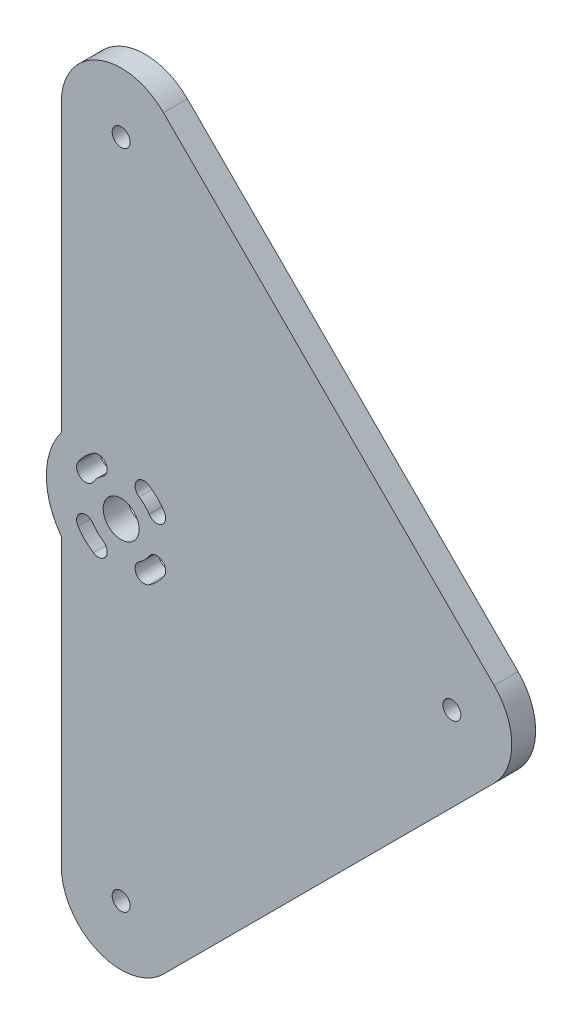
from build123d import *

# Parameters (mm, degrees)
SKETCH_1_R      = 3
SKETCH_1_R_2    = 1.5
EXTRUDE_1_DEPTH = 4


with BuildPart() as part:
    # 草图1 → 凸台-拉伸1 (new body)
    with BuildSketch(Plane.XY):
        with BuildLine():
            Line((1790.797367784, 1613.266845989), (1790.797367784, 1565.512011993))
            ThreePointArc((1790.797367784, 1565.512011993), (1788.297367784, 1558.012011993), (1790.797367784, 1550.512011993))
            Line((1790.797367784, 1550.512011993), (1790.797367784, 1502.757177997))
            ThreePointArc((1790.797367784, 1502.757177997), (1796.970533461, 1493.518382672), (1807.868435596, 1495.686110185))
            Line((1807.868435596, 1495.686110185), (1863.123269592, 1550.940944181))
            ThreePointArc((1863.123269592, 1550.940944181), (1866.05220178, 1558.012011993), (1863.123269592, 1565.083079805))
            Line((1863.123269592, 1565.083079805), (1807.868435596, 1620.337913801))
            ThreePointArc((1807.868435596, 1620.337913801), (1796.970533461, 1622.505641314), (1790.797367784, 1613.266845989))
        make_face()
        with Locations((1800.797367784, 1558.012011993)):
            Circle(SKETCH_1_R, mode=Mode.SUBTRACT)
        with Locations((1800.797367784, 1613.266845989)):
            Circle(SKETCH_1_R_2, mode=Mode.SUBTRACT)
        with Locations((1856.05220178, 1558.012011993)):
            Circle(SKETCH_1_R_2, mode=Mode.SUBTRACT)
        with Locations((1800.797367784, 1502.757177997)):
            Circle(SKETCH_1_R_2, mode=Mode.SUBTRACT)
        with BuildLine():
            ThreePointArc((1805.443255224, 1550.809308797), (1806.858027956, 1551.951351821), (1808.000070981, 1553.366124554))
            ThreePointArc((1808.000070981, 1553.366124554), (1807.55260939, 1555.43971519), (1805.479018754, 1554.992253599))
            ThreePointArc((1805.479018754, 1554.992253599), (1804.736707613, 1554.072672165), (1803.817126178, 1553.330361023))
            ThreePointArc((1803.817126178, 1553.330361023), (1803.369664588, 1551.256770387), (1805.443255224, 1550.809308797))
        make_face(mode=Mode.SUBTRACT)
        with BuildLine():
            ThreePointArc((1808.000070981, 1562.657899433), (1806.858027956, 1564.072672165), (1805.443255224, 1565.21471519))
            ThreePointArc((1805.443255224, 1565.21471519), (1803.369664588, 1564.767253599), (1803.817126178, 1562.693662963))
            ThreePointArc((1803.817126178, 1562.693662963), (1804.736707613, 1561.951351821), (1805.479018754, 1561.031770387))
            ThreePointArc((1805.479018754, 1561.031770387), (1807.55260939, 1560.584308797), (1808.000070981, 1562.657899433))
        make_face(mode=Mode.SUBTRACT)
        with BuildLine():
            ThreePointArc((1796.151480345, 1565.21471519), (1794.736707613, 1564.072672165), (1793.594664588, 1562.657899433))
            ThreePointArc((1793.594664588, 1562.657899433), (1794.042126178, 1560.584308797), (1796.115716814, 1561.031770387))
            ThreePointArc((1796.115716814, 1561.031770387), (1796.858027956, 1561.951351821), (1797.77760939, 1562.693662963))
            ThreePointArc((1797.77760939, 1562.693662963), (1798.225070981, 1564.767253599), (1796.151480345, 1565.21471519))
        make_face(mode=Mode.SUBTRACT)
        with BuildLine():
            ThreePointArc((1793.594664588, 1553.366124554), (1794.736707613, 1551.951351821), (1796.151480345, 1550.809308797))
            ThreePointArc((1796.151480345, 1550.809308797), (1798.225070981, 1551.256770387), (1797.77760939, 1553.330361023))
            ThreePointArc((1797.77760939, 1553.330361023), (1796.858027956, 1554.072672165), (1796.115716814, 1554.992253599))
            ThreePointArc((1796.115716814, 1554.992253599), (1794.042126178, 1555.43971519), (1793.594664588, 1553.366124554))
        make_face(mode=Mode.SUBTRACT)
    extrude(amount=EXTRUDE_1_DEPTH)


solid = part.part
